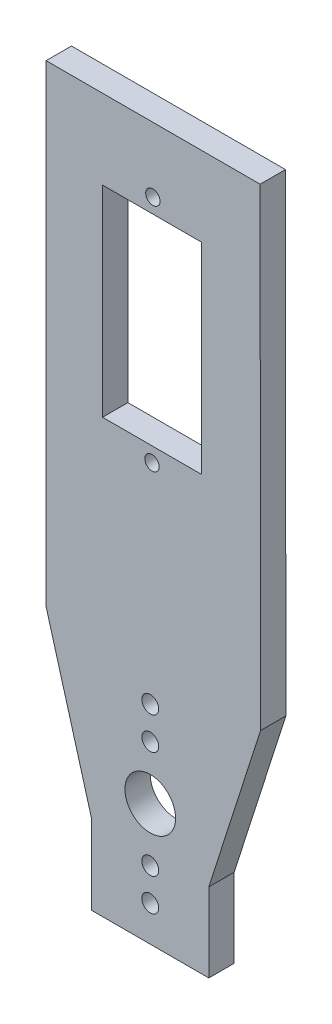
from build123d import *

# Parameters (mm, degrees)
SKETCH1_R           = 0.85
SKETCH1_R_2         = 3
SKETCH1_W           = 11.7094
SKETCH1_H           = 23.7998
BOSS_EXTRUDE3_DEPTH = 3
SKETCH2_R           = 1.0009
CUT_EXTRUDE1_DEPTH  = 447.747926613


with BuildPart() as part:
    # Sketch1 → Boss-Extrude3 (new body)
    with BuildSketch(Plane.XY):
        Polygon((-363.784573438, 176.492478394), (-369.180567886, 195.576225703), (-369.180567886, 251.55599422), (-343.853730339, 251.55599422), (-343.806464443, 195.576225703), (-349.928026562, 176.492478394), (-349.928026562, 167.153932289), (-363.784573438, 167.153932289), align=None)
        with Locations((-356.653301567, 216.60430982)):
            Circle(SKETCH1_R, mode=Mode.SUBTRACT)
        with Locations((-356.547049339, 243.88030982)):
            Circle(SKETCH1_R, mode=Mode.SUBTRACT)
        with Locations((-356.8563, 181.55599422)):
            Circle(SKETCH1_R_2, mode=Mode.SUBTRACT)
        with Locations((-356.646530889, 230.24230982)):
            Rectangle(SKETCH1_W, SKETCH1_H, mode=Mode.SUBTRACT)
    extrude(amount=BOSS_EXTRUDE3_DEPTH)

    # Sketch2 → Cut-Extrude1 (cut, through all)
    with BuildSketch(Plane.XY.offset(3)):
        with Locations((-356.8563, 171.35599422)):
            Circle(SKETCH2_R)
        with Locations((-356.8563, 175.20599422)):
            Circle(SKETCH2_R)
        with Locations((-356.8563, 187.90599422)):
            Circle(SKETCH2_R)
        with Locations((-356.8563, 191.75599422)):
            Circle(SKETCH2_R)
    extrude(amount=-CUT_EXTRUDE1_DEPTH, mode=Mode.SUBTRACT)


solid = part.part
